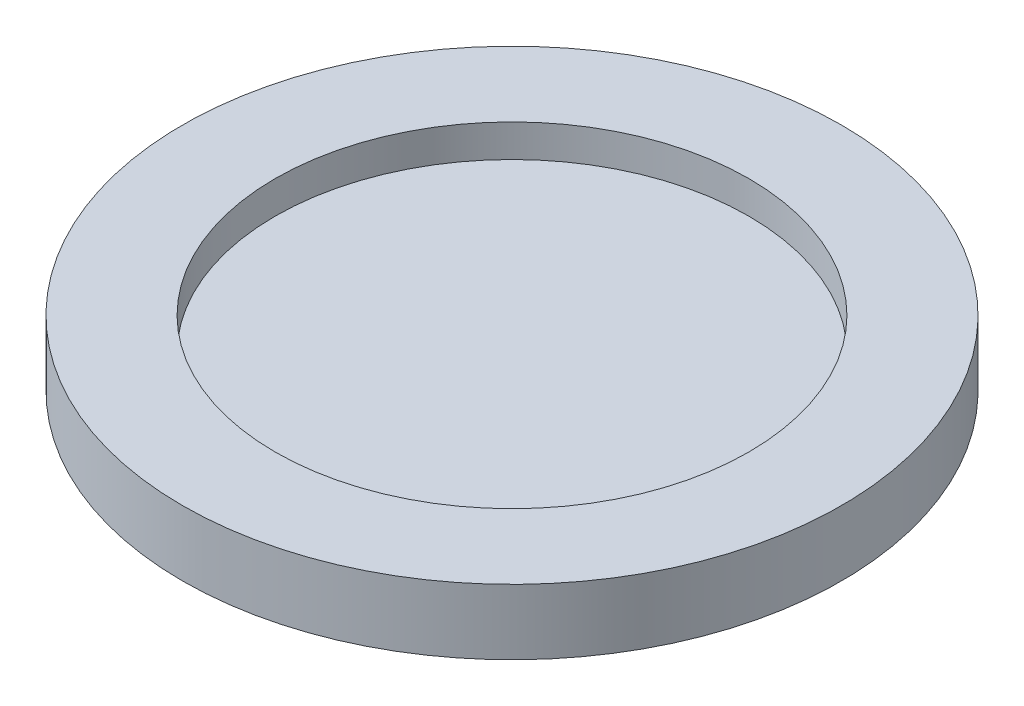
from build123d import *

# Parameters (mm, degrees)
SKETCH1_R           = 13.589
SKETCH1_R_2         = 9.7663
BOSS_EXTRUDE1_DEPTH = 2.6924
SKETCH3_R           = 9.7663
BOSS_EXTRUDE2_DEPTH = 1.35
SKETCH4_R           = 9.7663
CUT_EXTRUDE1_DEPTH  = 1.25


with BuildPart() as part:
    # Sketch1 → Boss-Extrude1 (new body)
    with BuildSketch(Plane(origin=(0, 0, 0), x_dir=(1, 0, 0), z_dir=(0, 1, 0))):
        with Locations(Location((0, 0, 0), (0, 0, 270))):
            Circle(SKETCH1_R)
        with Locations(Location((0, 0, 0), (0, 0, 270))):
            Circle(SKETCH1_R_2, mode=Mode.SUBTRACT)
    extrude(amount=BOSS_EXTRUDE1_DEPTH)

    # Sketch3 → Boss-Extrude2 (add)
    with BuildSketch(Plane(origin=(0, 0, 0), x_dir=(1, 0, 0), z_dir=(0, 1, 0))):
        with Locations(Location((0, 0, 0), (0, 0, 270))):
            Circle(SKETCH3_R)
    extrude(amount=BOSS_EXTRUDE2_DEPTH)

    # Sketch4 → Cut-Extrude1 (cut)
    with BuildSketch(Plane.XZ):
        with Locations(Location((0, 0, 0), (0, 0, 90))):
            Circle(SKETCH4_R)
    extrude(amount=-CUT_EXTRUDE1_DEPTH, mode=Mode.SUBTRACT)


solid = part.part
